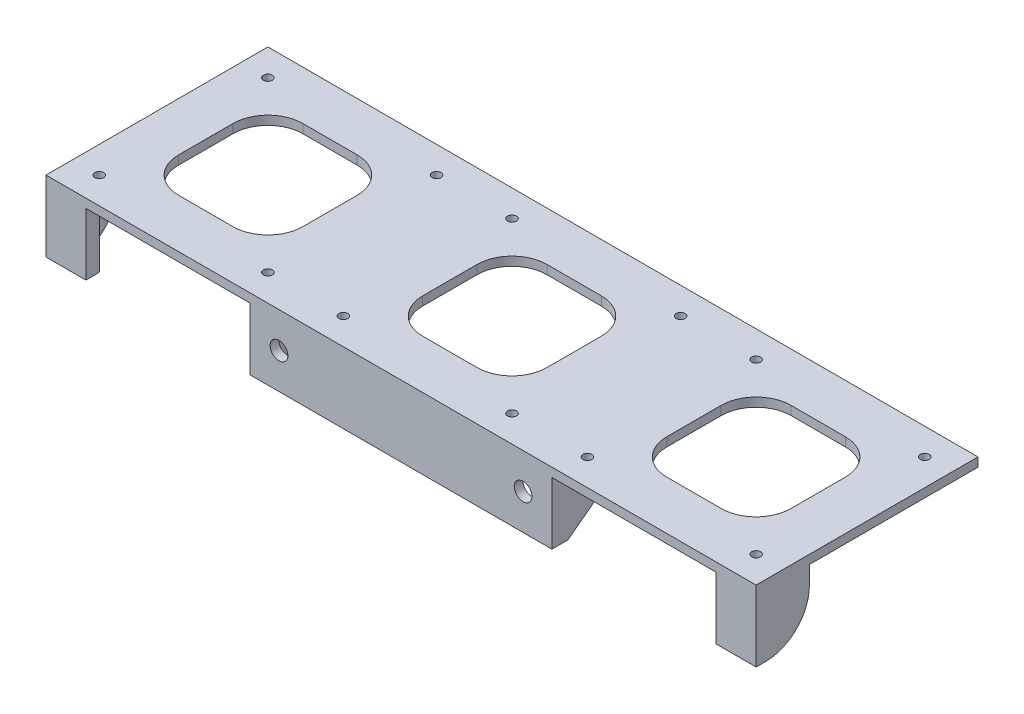
from build123d import *
from OCP.BRepFilletAPI import BRepFilletAPI_MakeChamfer

# Parameters (mm, degrees)
SKETCH1_W           = 203.2
SKETCH1_H           = 63.5
SKETCH1_R           = 1.27
BOSS_EXTRUDE1_DEPTH = 2.54
SKETCH2_W           = 86.36
SKETCH2_H           = 20.32
SKETCH2_R           = 2.54
BOSS_EXTRUDE2_DEPTH = 2.54
SKETCH3_W           = 3.81
SKETCH3_H           = 25.4
BOSS_EXTRUDE3_DEPTH = 17.78
CHAMFER1_SIZE       = 17.62
CHAMFER1_SIZE2      = 23.382529757
SKETCH4_W           = 35.56
SKETCH4_H           = 35.56
CUT_EXTRUDE1_DEPTH  = 214.631969518
FILLET1_R           = 10
BOSS_EXTRUDE4_DEPTH = 17.78
FILLET2_R           = 12.54


with BuildPart() as part:
    # Sketch1 → Boss-Extrude1 (new body)
    with BuildSketch(Plane(origin=(0, 0, 0), x_dir=(1, 0, 0), z_dir=(0, 1, 0))):
        with Locations((101.6, 31.75)):
            Rectangle(SKETCH1_W, SKETCH1_H)
        with Locations(Location((7.62, 55.88, 0), (0, 0, 270))):
            Circle(SKETCH1_R, mode=Mode.SUBTRACT)
        with Locations(Location((55.88, 55.88, 0), (0, 0, 270))):
            Circle(SKETCH1_R, mode=Mode.SUBTRACT)
        with Locations(Location((7.62, 7.62, 0), (0, 0, 270))):
            Circle(SKETCH1_R, mode=Mode.SUBTRACT)
        with Locations(Location((55.88, 7.62, 0), (0, 0, 270))):
            Circle(SKETCH1_R, mode=Mode.SUBTRACT)
        with Locations(Location((77.47, 55.88, 0), (0, 0, 270))):
            Circle(SKETCH1_R, mode=Mode.SUBTRACT)
        with Locations(Location((125.73, 55.88, 0), (0, 0, 270))):
            Circle(SKETCH1_R, mode=Mode.SUBTRACT)
        with Locations(Location((125.73, 7.62, 0), (0, 0, 270))):
            Circle(SKETCH1_R, mode=Mode.SUBTRACT)
        with Locations(Location((77.47, 7.62, 0), (0, 0, 270))):
            Circle(SKETCH1_R, mode=Mode.SUBTRACT)
        with Locations(Location((147.32, 55.88, 0), (0, 0, 270))):
            Circle(SKETCH1_R, mode=Mode.SUBTRACT)
        with Locations(Location((195.58, 55.88, 0), (0, 0, 270))):
            Circle(SKETCH1_R, mode=Mode.SUBTRACT)
        with Locations(Location((195.58, 7.62, 0), (0, 0, 270))):
            Circle(SKETCH1_R, mode=Mode.SUBTRACT)
        with Locations(Location((147.32, 7.62, 0), (0, 0, 270))):
            Circle(SKETCH1_R, mode=Mode.SUBTRACT)
    extrude(amount=BOSS_EXTRUDE1_DEPTH)

    # Sketch2 → Boss-Extrude2 (add)
    with BuildSketch(Plane.XY):
        with Locations((101.6, -7.62)):
            Rectangle(SKETCH2_W, SKETCH2_H)
        with Locations((66.675, -7.62)):
            Circle(SKETCH2_R, mode=Mode.SUBTRACT)
        with Locations((136.525, -7.62)):
            Circle(SKETCH2_R, mode=Mode.SUBTRACT)
    extrude(amount=-BOSS_EXTRUDE2_DEPTH)

    # Sketch3 → Boss-Extrude3 (add)
    with BuildSketch(Plane.XZ):
        with Locations((60.325, -15.24)):
            Rectangle(SKETCH3_W, SKETCH3_H)
        with Locations((142.875, -15.24)):
            Rectangle(SKETCH3_W, SKETCH3_H)
    extrude(amount=BOSS_EXTRUDE3_DEPTH)

    # Chamfer1: one chamfer whose edges measure the first distance from different faces: ONE call of the kernel's chamfer builder (chamfer() names one face for all edges)
    chamfer1_edges_1 = [part.edges().sort_by_distance(p)[0] for p in [
        (142.875, -17.78, -27.94),
    ]]
    chamfer1_side_1 = [part.faces().sort_by_distance(p)[0] for p in [
        (142.875, -8.89, -27.94),
    ]]
    chamfer1_edges_2 = [part.edges().sort_by_distance(p)[0] for p in [
        (60.325, -17.78, -27.94),
    ]]
    chamfer1_side_2 = [part.faces().sort_by_distance(p)[0] for p in [
        (60.325, -8.89, -27.94),
    ]]
    chamfer1 = BRepFilletAPI_MakeChamfer(part.part.solid().wrapped)
    for e in chamfer1_edges_1:
        chamfer1.Add(CHAMFER1_SIZE, CHAMFER1_SIZE2, e.wrapped, chamfer1_side_1[0].wrapped)  # the first distance lies on this face
    for e in chamfer1_edges_2:
        chamfer1.Add(CHAMFER1_SIZE, CHAMFER1_SIZE2, e.wrapped, chamfer1_side_2[0].wrapped)  # the first distance lies on this face
    add(Compound.cast(chamfer1.Shape()), mode=Mode.REPLACE)

    # Sketch4 → Cut-Extrude1 (cut, through all)
    with BuildSketch(Plane.XZ):
        with Locations((31.75, -31.75)):
            Rectangle(SKETCH4_W, SKETCH4_H)
        with Locations((101.6, -31.75)):
            Rectangle(SKETCH4_W, SKETCH4_H)
        with Locations((171.45, -31.75)):
            Rectangle(SKETCH4_W, SKETCH4_H)
    extrude(amount=-CUT_EXTRUDE1_DEPTH, mode=Mode.SUBTRACT)

    # Fillet1
    fillet1_edges = [part.edges().sort_by_distance(p)[0] for p in [
        (13.97, 1.27, -49.53),
        (13.97, 1.27, -13.97),
        (49.53, 1.27, -13.97),
        (49.53, 1.27, -49.53),
        (83.82, 1.27, -49.53),
        (83.82, 1.27, -13.97),
        (119.38, 1.27, -13.97),
        (119.38, 1.27, -49.53),
        (153.67, 1.27, -49.53),
        (153.67, 1.27, -13.97),
        (189.23, 1.27, -13.97),
        (189.23, 1.27, -49.53),
    ]]
    fillet(fillet1_edges, radius=FILLET1_R)

    # Sketch5 → Boss-Extrude4 (add)
    with BuildSketch(Plane.XZ):
        Polygon((0, 0), (5.08, 0), (11.43, 0), (11.43, -3.81), (5.08, -3.81), (5.08, -15.24), (0, -15.24), align=None)
        Polygon((203.2, 0), (191.77, 0), (191.77, -3.81), (198.12, -3.81), (198.12, -15.24), (203.2, -15.24), align=None)
    extrude(amount=BOSS_EXTRUDE4_DEPTH)

    # Fillet2
    fillet2_edges = [part.edges().sort_by_distance(p)[0] for p in [
        (200.66, -17.78, -15.24),
        (2.54, -17.78, -15.24),
    ]]
    fillet(fillet2_edges, radius=FILLET2_R)


solid = part.part
